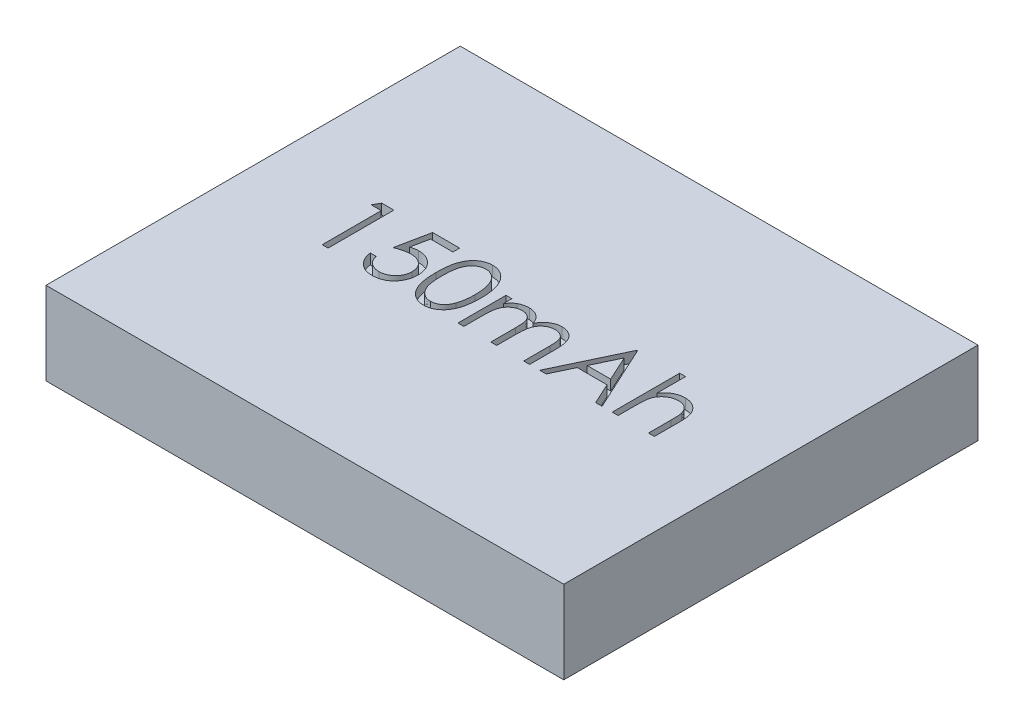
from build123d import *

# Parameters (mm, degrees)
SKETCH1_W           = 25
SKETCH1_H           = 20
BOSS_EXTRUDE1_DEPTH = 4
CUT_EXTRUDE1_DEPTH  = 0.5


with BuildPart() as part:
    # Sketch1 → Boss-Extrude1 (new body)
    with BuildSketch(Plane(origin=(0, 0, 0), x_dir=(1, 0, 0), z_dir=(0, 1, 0))):
        with Locations((12.5, 10)):
            Rectangle(SKETCH1_W, SKETCH1_H)
    extrude(amount=BOSS_EXTRUDE1_DEPTH)

    # Sketch2 → Cut-Extrude1 (cut)
    # profile 1 of 6: a face of its own
    with BuildSketch(Plane(origin=(0, 4, 0), x_dir=(1, 0, 0), z_dir=(0, 1, 0))):
        Polygon((4.668867262, 11.540645792), (5.255911533, 11.540645792), (5.255911533, 8.365645792), (4.970975635, 8.365645792), (4.970975635, 11.215004766), (4.482514097, 11.215004766), align=None)
    # profile 2 of 6: a face of its own
    with BuildSketch(Plane(origin=(0, 4, 0), x_dir=(1, 0, 0), z_dir=(0, 1, 0))):
        with BuildLine():
            Line((8.430911533, 11.540645792), (8.430911533, 11.215004766))
            Line((8.430911533, 11.215004766), (7.351589618, 11.215004766))
            Line((7.351589618, 11.215004766), (7.179864858, 10.37991362))
            add(Edge.make_bspline(
                [(7.179864858, 10.37991362), (7.21347983, 10.389193938), (7.278603521, 10.407173086), (7.374724252, 10.427135464), (7.465975751, 10.439169117), (7.525189837, 10.440812234), (7.553843223, 10.44160733)],
                knots=[0, 0, 0, 0, 1.100273476, 2.13160584, 3.095893838, 4, 4, 4, 4], degree=3))
            add(Edge.make_bspline(
                [(7.553843223, 10.44160733), (7.589297759, 10.440839946), (7.659010234, 10.439331076), (7.761008421, 10.424842327), (7.858374689, 10.402036833), (7.95090541, 10.370177502), (8.038771767, 10.329437959), (8.12116534, 10.278547298), (8.199322876, 10.219099205), (8.271842229, 10.150750516), (8.337632137, 10.075528763), (8.395476999, 9.994649837), (8.444610206, 9.908899744), (8.484126034, 9.817459192), (8.515680394, 9.721339103), (8.536682561, 9.619528117), (8.550667718, 9.512985894), (8.552230169, 9.440138177), (8.553026917, 9.402990543)],
                knots=[0, 0, 0, 0, 1.052922333, 2.070308379, 3.05430497, 4.020497103, 4.973039431, 5.925935799, 6.892292201, 7.88610001, 8.88166317, 9.857072816, 10.836096531, 11.812156883, 12.81219415, 13.836441305, 14.89672472, 16, 16, 16, 16], degree=3))
            add(Edge.make_bspline(
                [(8.553026917, 9.402990543), (8.552423599, 9.377116815), (8.551225116, 9.325719019), (8.545130397, 9.249388208), (8.533395855, 9.174673352), (8.517640848, 9.10156454), (8.497191654, 9.030200181), (8.472436584, 8.960376009), (8.442141616, 8.892526616), (8.408911726, 8.826010007), (8.371495278, 8.762329933), (8.329967632, 8.702776924), (8.286093222, 8.646457611), (8.238884251, 8.593976011), (8.18790192, 8.545676987), (8.133763664, 8.501273903), (8.076901483, 8.46001584), (8.016435656, 8.423577548), (7.953713547, 8.390046867), (7.887829378, 8.362539086), (7.820282886, 8.337945964), (7.750101891, 8.318343036), (7.677445361, 8.30298279), (7.602193529, 8.292550102), (7.524741064, 8.284951477), (7.47224016, 8.28447581), (7.445720227, 8.284235535)],
                knots=[0, 0, 0, 0, 1.056347294, 2.098418968, 3.122841568, 4.141288669, 5.149314143, 6.15115421, 7.162517403, 8.180376062, 9.185164535, 10.17417709, 11.141909838, 12.097768115, 13.052685741, 14.0056014, 14.954263652, 15.917497458, 16.885230207, 17.854509472, 18.828990115, 19.81800267, 20.826176721, 21.857883937, 22.917946725, 24, 24, 24, 24], degree=3))
            add(Edge.make_bspline(
                [(7.445720227, 8.284235535), (7.414084363, 8.284862224), (7.351844538, 8.28609516), (7.260658023, 8.298993357), (7.17292406, 8.317466339), (7.089348896, 8.345257812), (7.009183536, 8.380080572), (6.933507213, 8.424091671), (6.860386259, 8.473965572), (6.792793197, 8.532821321), (6.730058723, 8.597151975), (6.673900676, 8.66696355), (6.623886645, 8.741103829), (6.580817546, 8.819932869), (6.544080055, 8.903243536), (6.515219316, 8.991347973), (6.49192538, 9.083785833), (6.482070706, 9.147425089), (6.477065379, 9.179748356)],
                knots=[0, 0, 0, 0, 1.0467383, 2.05933395, 3.04377827, 4.011590433, 4.970194871, 5.932262533, 6.905835911, 7.896367577, 8.894135286, 9.877477877, 10.858688626, 11.851381753, 12.8477658, 13.868841284, 14.917554742, 16, 16, 16, 16], degree=3))
            Line((6.477065379, 9.179748356), (6.762001276, 9.179748356))
            add(Edge.make_bspline(
                [(6.762001276, 9.179748356), (6.769012182, 9.149471145), (6.782487532, 9.091276666), (6.812065604, 9.009514663), (6.848229648, 8.936653653), (6.891232164, 8.871729817), (6.94253112, 8.815115941), (7.001068531, 8.76466332), (7.066698251, 8.71914731), (7.139626395, 8.681208086), (7.216563974, 8.648851431), (7.297088515, 8.62730525), (7.379007458, 8.612155155), (7.434414265, 8.610638629), (7.462256685, 8.609876561)],
                knots=[0, 0, 0, 0, 1.136247022, 2.183929868, 3.172523383, 4.106158343, 5.02341133, 5.958108904, 6.928429099, 7.938127109, 8.96079061, 9.975095812, 10.982467395, 12, 12, 12, 12], degree=3))
            add(Edge.make_bspline(
                [(7.462256685, 8.609876561), (7.489433274, 8.610621124), (7.5429442, 8.612087174), (7.621694529, 8.623371135), (7.697724779, 8.640749789), (7.770284739, 8.666757443), (7.840644135, 8.69836658), (7.907023198, 8.738929542), (7.971342237, 8.78561113), (8.031602044, 8.839093216), (8.086792116, 8.89803001), (8.135556597, 8.961055932), (8.176175654, 9.0282905), (8.210405881, 9.098569717), (8.236398517, 9.172663837), (8.254941407, 9.250225617), (8.265829896, 9.331446635), (8.267327752, 9.386845223), (8.26809102, 9.415074878)],
                knots=[0, 0, 0, 0, 1.027316725, 2.022795036, 3.002884548, 3.971462791, 4.93288096, 5.914575861, 6.907176829, 7.935150275, 8.956128384, 9.956726525, 10.942570165, 11.921478529, 12.907843606, 13.90538589, 14.932640048, 16, 16, 16, 16], degree=3))
            add(Edge.make_bspline(
                [(8.26809102, 9.415074878), (8.267493685, 9.440543596), (8.266324487, 9.490394986), (8.256771755, 9.563328552), (8.240155645, 9.632337669), (8.217092554, 9.697755581), (8.187810429, 9.75964399), (8.152026988, 9.818066766), (8.109070691, 9.872253886), (8.060001621, 9.922230703), (8.006246113, 9.968354268), (7.946879289, 10.007673546), (7.883143498, 10.040751528), (7.815806647, 10.069297498), (7.743267061, 10.089799603), (7.666961258, 10.105191899), (7.586065245, 10.114095835), (7.530756121, 10.115331263), (7.502325796, 10.115966304)],
                knots=[0, 0, 0, 0, 1.045622112, 2.046656509, 3.013763289, 3.955457236, 4.890082067, 5.820317437, 6.762574623, 7.722996705, 8.69280354, 9.665887285, 10.63943826, 11.638615906, 12.663482002, 13.728887084, 14.832589034, 16, 16, 16, 16], degree=3))
            add(Edge.make_bspline(
                [(7.502325796, 10.115966304), (7.477715982, 10.115439625), (7.426902959, 10.114352167), (7.348958681, 10.106345273), (7.267051189, 10.093428199), (7.181494468, 10.075660674), (7.092031579, 10.052409626), (6.998851315, 10.024547186), (6.901757759, 9.991235087), (6.836336681, 9.966078008), (6.802706405, 9.953145792)],
                knots=[0, 0, 0, 0, 0.817624296, 1.688186739, 2.600797293, 3.572016777, 4.590301741, 5.671205678, 6.80286297, 8, 8, 8, 8], degree=3))
            Line((6.802706405, 9.953145792), (7.12834743, 11.540645792))
            Line((7.12834743, 11.540645792), (8.430911533, 11.540645792))
        make_face()
    # profile 3 of 6: a face of its own
    with BuildSketch(Plane(origin=(0, 4, 0), x_dir=(1, 0, 0), z_dir=(0, 1, 0))):
        with BuildLine():
            add(Edge.make_bspline(
                [(8.878667943, 9.951873756), (8.878965502, 10.002762101), (8.879543516, 10.101613444), (8.885973726, 10.245653798), (8.896655644, 10.38078206), (8.911294546, 10.507004698), (8.929109, 10.624354299), (8.952890191, 10.732517257), (8.979934662, 10.831994186), (9.011278667, 10.923109473), (9.046646161, 11.007090675), (9.085140097, 11.085490679), (9.128288161, 11.15819086), (9.17362436, 11.22635157), (9.222983883, 11.288857065), (9.274962071, 11.346590052), (9.33158763, 11.398216232), (9.390935645, 11.445248235), (9.453543438, 11.486477399), (9.517626428, 11.522792812), (9.583625702, 11.553816977), (9.651721454, 11.578210444), (9.721301631, 11.598358855), (9.79260947, 11.6121374), (9.865762708, 11.620806881), (9.915139795, 11.621635709), (9.940181365, 11.622056048)],
                knots=[0, 0, 0, 0, 1.646270934, 3.197905019, 4.663502075, 6.030701355, 7.308322542, 8.50163776, 9.611534131, 10.641858119, 11.616356847, 12.558055219, 13.465016945, 14.349605745, 15.204443733, 16.039544428, 16.859896111, 17.680448484, 18.487036065, 19.28249412, 20.06191084, 20.843045899, 21.620316918, 22.403196591, 23.190181807, 24, 24, 24, 24], degree=3))
            add(Edge.make_bspline(
                [(9.940181365, 11.622056048), (9.96543212, 11.62161353), (10.015647928, 11.620733501), (10.08988884, 11.612275353), (10.162414623, 11.598240834), (10.232916077, 11.578355379), (10.301972315, 11.553685015), (10.369043199, 11.52276313), (10.434545337, 11.486768729), (10.497437812, 11.444474212), (10.55841107, 11.397318861), (10.615967437, 11.344012726), (10.67011215, 11.285094052), (10.721524749, 11.221193218), (10.768746612, 11.151084605), (10.813716797, 11.075987592), (10.853968573, 10.994588879), (10.892735028, 10.908246597), (10.926196794, 10.814571707), (10.956374031, 10.714092245), (10.980757096, 10.605621376), (11.001067364, 10.48972821), (11.016801662, 10.365987136), (11.028261273, 10.234663407), (11.034314715, 10.095670624), (11.035454722, 10.00064029), (11.036039738, 9.951873756)],
                knots=[0, 0, 0, 0, 0.810914788, 1.612654377, 2.396697861, 3.181598691, 3.963628158, 4.749916497, 5.551656086, 6.361998678, 7.18212741, 8.025565596, 8.878627764, 9.750805457, 10.657531673, 11.591944965, 12.560506719, 13.57287815, 14.630710178, 15.753379473, 16.941251878, 18.199788006, 19.531962791, 20.947069417, 22.433333509, 24, 24, 24, 24], degree=3))
            add(Edge.make_bspline(
                [(11.036039738, 9.951873756), (11.035448658, 9.903319926), (11.034296962, 9.808714766), (11.028329135, 9.670347382), (11.016573805, 9.539720585), (11.00186903, 9.416521094), (10.981502799, 9.301261683), (10.95646097, 9.193543505), (10.928656749, 9.092901382), (10.894335185, 9.000159803), (10.856769755, 8.914025026), (10.815898256, 8.833591256), (10.772110628, 8.758147548), (10.724405124, 8.688297777), (10.67355667, 8.623547138), (10.618476962, 8.565038581), (10.560718645, 8.511362328), (10.499565954, 8.46359978), (10.435692618, 8.421794279), (10.370415455, 8.384407429), (10.302576243, 8.354260627), (10.233712351, 8.328375268), (10.162838761, 8.308599144), (10.090043821, 8.294925004), (10.015697807, 8.285334827), (9.965440673, 8.284603235), (9.940181365, 8.284235535)],
                knots=[0, 0, 0, 0, 1.561518951, 3.042555995, 4.452378317, 5.7783523, 7.031515105, 8.214008947, 9.334062868, 10.386615937, 11.391082383, 12.354592575, 13.286541444, 14.194233754, 15.072674879, 15.931287219, 16.775624067, 17.606195743, 18.42308326, 19.229000347, 20.022332153, 20.807536673, 21.593273796, 22.3848459, 23.188221202, 24, 24, 24, 24], degree=3))
            add(Edge.make_bspline(
                [(9.940181365, 8.284235535), (9.91514049, 8.284658586), (9.865764772, 8.28549276), (9.792601501, 8.294123074), (9.721588141, 8.30799828), (9.652374271, 8.3274262), (9.58460479, 8.351206801), (9.519203158, 8.382189071), (9.455442188, 8.417870691), (9.393491991, 8.458506538), (9.334516673, 8.505062636), (9.278184367, 8.556555955), (9.225910243, 8.614271478), (9.177256456, 8.67729788), (9.131015676, 8.745055321), (9.088480316, 8.818468917), (9.049136755, 8.89724757), (9.013174446, 8.981900246), (8.981289587, 9.073662217), (8.95312488, 9.173583257), (8.930887038, 9.282545299), (8.911852499, 9.399673196), (8.896499666, 9.525470261), (8.886018243, 9.660004789), (8.87954005, 9.803192942), (8.87896395, 9.901409095), (8.878667943, 9.951873756)],
                knots=[0, 0, 0, 0, 0.810891512, 1.598919785, 2.382837074, 3.152667961, 3.926044502, 4.706494248, 5.493654104, 6.291793342, 7.103789334, 7.925228297, 8.761435821, 9.622817696, 10.50288917, 11.416980706, 12.369136599, 13.353924996, 14.394355917, 15.514179734, 16.714354668, 17.994756427, 19.357759367, 20.818452758, 22.365282078, 24, 24, 24, 24], degree=3))
        make_face()
        with BuildLine():
            add(Edge.make_bspline(
                [(9.16360384, 9.953145792), (9.163712196, 9.910738043), (9.163922493, 9.828432931), (9.169416332, 9.708832259), (9.176900471, 9.597280603), (9.186553648, 9.493636324), (9.20088918, 9.398250241), (9.216951766, 9.310466314), (9.236498961, 9.230749106), (9.259626585, 9.158551592), (9.285969194, 9.092648509), (9.314730942, 9.031324549), (9.345628883, 8.973855293), (9.380208398, 8.920756948), (9.417868491, 8.871856356), (9.457758519, 8.826288001), (9.501367221, 8.78565074), (9.561695616, 8.736912807), (9.64133956, 8.686549021), (9.741688116, 8.642692211), (9.84480164, 8.615130983), (9.914788845, 8.611626004), (9.949721629, 8.609876561)],
                knots=[0, 0, 0, 0, 1.459021318, 2.831673884, 4.118529203, 5.306027144, 6.411944654, 7.436330062, 8.375795394, 9.233974572, 10.042671642, 10.816086306, 11.563610507, 12.285937304, 12.993564865, 13.685989202, 14.367179055, 15.041617293, 16.353048772, 17.594441528, 18.799311195, 20, 20, 20, 20], degree=3))
            add(Edge.make_bspline(
                [(9.949721629, 8.609876561), (9.984880374, 8.611325976), (10.055125274, 8.614221815), (10.157753788, 8.642160669), (10.257385533, 8.68431518), (10.335465079, 8.734160417), (10.394867101, 8.781629687), (10.437427513, 8.822101547), (10.476490943, 8.867418655), (10.513540539, 8.916313016), (10.547521272, 8.96971877), (10.578421404, 9.027379106), (10.606618441, 9.089454146), (10.622683076, 9.132788124), (10.630896509, 9.154943668)],
                knots=[0, 0, 0, 0, 1.353760809, 2.704726607, 4.075137775, 5.516104923, 6.260822281, 7.007110065, 7.778089737, 8.566572457, 9.372053459, 10.217411131, 11.088608312, 12, 12, 12, 12], degree=3))
            add(Edge.make_bspline(
                [(10.630896509, 9.154943668), (10.64046847, 9.183273503), (10.659903655, 9.240795218), (10.684951479, 9.330025102), (10.704677662, 9.423644753), (10.72242443, 9.52109468), (10.734537559, 9.623093551), (10.744287361, 9.729325771), (10.750030199, 9.839871435), (10.75074208, 9.91497832), (10.75110384, 9.953145792)],
                knots=[0, 0, 0, 0, 0.884706709, 1.796334032, 2.740027952, 3.714592787, 4.726048262, 5.777819803, 6.87074269, 8, 8, 8, 8], degree=3))
            add(Edge.make_bspline(
                [(10.75110384, 9.953145792), (10.75060474, 9.99130709), (10.749628393, 10.065958746), (10.745896419, 10.175285953), (10.736259319, 10.279124565), (10.725555833, 10.377921922), (10.709774068, 10.471131125), (10.692758057, 10.559532473), (10.669896958, 10.642030789), (10.645476876, 10.719917695), (10.617527446, 10.792308289), (10.58676103, 10.859540081), (10.55390272, 10.921937652), (10.518213688, 10.979329807), (10.480117604, 11.031973613), (10.43860897, 11.078813567), (10.395334289, 11.121301388), (10.334721556, 11.169799576), (10.255369879, 11.219249471), (10.156631327, 11.264756982), (10.053878671, 11.290890219), (9.984415609, 11.294574749), (9.949721629, 11.296415022)],
                knots=[0, 0, 0, 0, 1.31362396, 2.569729283, 3.763502607, 4.902122613, 5.988968491, 7.01645872, 7.998833611, 8.933434873, 9.825090667, 10.667526885, 11.477055099, 12.250526234, 12.991942729, 13.710640831, 14.402115721, 15.076753259, 16.378508321, 17.609869233, 18.806226677, 20, 20, 20, 20], degree=3))
            add(Edge.make_bspline(
                [(9.949721629, 11.296415022), (9.914605592, 11.29457221), (9.844309545, 11.290883228), (9.7404889, 11.264854348), (9.640971381, 11.219485443), (9.56182954, 11.169635791), (9.501174533, 11.122157466), (9.458463804, 11.080985468), (9.41841692, 11.035949223), (9.381525506, 10.986598915), (9.346973085, 10.933562474), (9.315240309, 10.876422666), (9.286649588, 10.814889929), (9.260265759, 10.749016448), (9.237067587, 10.676825163), (9.217932349, 10.597206147), (9.200254808, 10.509701431), (9.187740528, 10.413798735), (9.17661555, 10.310128495), (9.169466042, 10.198298357), (9.163904115, 10.078497097), (9.163705937, 9.995766432), (9.16360384, 9.953145792)],
                knots=[0, 0, 0, 0, 1.207732386, 2.417664972, 3.655092373, 4.956220595, 5.625982001, 6.301752483, 6.994047911, 7.697131622, 8.419323945, 9.170223765, 9.943494443, 10.752040957, 11.610060368, 12.549350801, 13.567764191, 14.679664412, 15.874934091, 17.154273443, 18.533957287, 20, 20, 20, 20], degree=3))
        make_face(mode=Mode.SUBTRACT)
    # profile 4 of 6: a face of its own
    with BuildSketch(Plane(origin=(0, 4, 0), x_dir=(1, 0, 0), z_dir=(0, 1, 0))):
        with BuildLine():
            Line((11.524501276, 10.685838099), (11.809437174, 10.685838099))
            Line((11.809437174, 10.685838099), (11.809437174, 10.282602923))
            add(Edge.make_bspline(
                [(11.809437174, 10.282602923), (11.835094757, 10.317879533), (11.884257146, 10.3854729), (11.964870988, 10.474545515), (12.045403604, 10.550136055), (12.103400315, 10.589817089), (12.131262094, 10.608879966)],
                knots=[0, 0, 0, 0, 1.134379233, 2.173579362, 3.122582517, 4, 4, 4, 4], degree=3))
            add(Edge.make_bspline(
                [(12.131262094, 10.608879966), (12.169239323, 10.62702769), (12.244530275, 10.663006077), (12.363746286, 10.699503662), (12.485734022, 10.721932862), (12.568110045, 10.72500025), (12.60954735, 10.726543227)],
                knots=[0, 0, 0, 0, 1.014936303, 2.012140481, 3.000054389, 4, 4, 4, 4], degree=3))
            add(Edge.make_bspline(
                [(12.60954735, 10.726543227), (12.637571711, 10.725594999), (12.693030415, 10.723718507), (12.775203125, 10.711508332), (12.854903438, 10.69040259), (12.93166045, 10.661004517), (13.003978495, 10.625402165), (13.070280838, 10.583628502), (13.12981137, 10.536731869), (13.182540002, 10.482594551), (13.229955475, 10.419696351), (13.273569858, 10.346340926), (13.313869872, 10.260881119), (13.336204916, 10.198862899), (13.347963816, 10.166211697)],
                knots=[0, 0, 0, 0, 1.009824226, 1.998387844, 2.986035974, 3.974953746, 4.955485308, 5.885931332, 6.793869504, 7.679848016, 8.601185859, 9.625726857, 10.749998409, 12, 12, 12, 12], degree=3))
            add(Edge.make_bspline(
                [(13.347963816, 10.166211697), (13.36040188, 10.188640277), (13.384878243, 10.232776574), (13.425976928, 10.295240854), (13.469037, 10.353667016), (13.514425433, 10.408101415), (13.561982023, 10.458275242), (13.611930579, 10.504354381), (13.663986773, 10.546536718), (13.736369734, 10.595815584), (13.830542599, 10.648158798), (13.949276818, 10.693541744), (14.072784473, 10.721587089), (14.156620528, 10.724880265), (14.198955403, 10.726543227)],
                knots=[0, 0, 0, 0, 0.86119277, 1.694706429, 2.50939023, 3.298075842, 4.073795165, 4.829715201, 5.57930267, 6.321991688, 7.768977793, 9.186738141, 10.579381044, 12, 12, 12, 12], degree=3))
            add(Edge.make_bspline(
                [(14.198955403, 10.726543227), (14.237855016, 10.725076177), (14.313985335, 10.722205017), (14.424817569, 10.699659366), (14.528179063, 10.660944644), (14.62386184, 10.608118416), (14.710185385, 10.541734443), (14.785220894, 10.462750569), (14.84851258, 10.371725475), (14.889858918, 10.286098457), (14.917903479, 10.210501405), (14.935194741, 10.146088555), (14.950470751, 10.075193932), (14.963153737, 9.997732766), (14.972423424, 9.913431428), (14.979291144, 9.822427877), (14.983939411, 9.724651382), (14.984267862, 9.65719125), (14.984437174, 9.622416625)],
                knots=[0, 0, 0, 0, 1.209669288, 2.367440248, 3.500751976, 4.631527125, 5.755587489, 6.87532382, 8.007944318, 9.190864318, 9.82315674, 10.514484317, 11.263564316, 12.079023757, 12.955305781, 13.901327259, 14.918167583, 16, 16, 16, 16], degree=3))
            Line((14.984437174, 9.622416625), (14.984437174, 8.365645792))
            Line((14.984437174, 8.365645792), (14.699501276, 8.365645792))
            Line((14.699501276, 8.365645792), (14.699501276, 9.62368866))
            add(Edge.make_bspline(
                [(14.699501276, 9.62368866), (14.699430625, 9.653370895), (14.699294845, 9.710415636), (14.696851336, 9.792287503), (14.692247301, 9.866916656), (14.686863736, 9.934201336), (14.679385423, 9.994298451), (14.669728043, 10.047087288), (14.659497576, 10.092983102), (14.642501355, 10.14386116), (14.615334339, 10.199986279), (14.573952768, 10.260514094), (14.521819172, 10.313201677), (14.46162103, 10.358938293), (14.393087798, 10.396125382), (14.317554799, 10.422682905), (14.235490981, 10.439122945), (14.178683165, 10.440761259), (14.149346028, 10.44160733)],
                knots=[0, 0, 0, 0, 1.253487763, 2.409012846, 3.458416907, 4.410876679, 5.259312806, 6.014470957, 6.676830364, 7.243083969, 8.276244668, 9.299465089, 10.325150304, 11.392391894, 12.482080715, 13.603491619, 14.762376348, 16, 16, 16, 16], degree=3))
            add(Edge.make_bspline(
                [(14.149346028, 10.44160733), (14.113359712, 10.440322673), (14.042237071, 10.437783702), (13.938418666, 10.411863117), (13.838659244, 10.372783176), (13.745935516, 10.316148018), (13.660638877, 10.248286145), (13.587251403, 10.167596155), (13.526625063, 10.076310435), (13.485573242, 9.99181307), (13.459638662, 9.915912931), (13.442514603, 9.849603173), (13.429194669, 9.774236322), (13.416702832, 9.690318812), (13.408549679, 9.597273006), (13.401139798, 9.495529313), (13.39767373, 9.384781722), (13.397188899, 9.308013225), (13.396937174, 9.268154806)],
                knots=[0, 0, 0, 0, 1.090531906, 2.155305635, 3.229839962, 4.33261226, 5.44038871, 6.529323825, 7.629011124, 8.757537029, 9.370236727, 10.061839251, 10.834451254, 11.692844982, 12.636905849, 13.66920014, 14.789842145, 16, 16, 16, 16], degree=3))
            Line((13.396937174, 9.268154806), (13.396937174, 8.365645792))
            Line((13.396937174, 8.365645792), (13.112001276, 8.365645792))
            Line((13.112001276, 8.365645792), (13.112001276, 9.545458492))
            add(Edge.make_bspline(
                [(13.112001276, 9.545458492), (13.111929221, 9.578744574), (13.111790594, 9.64278365), (13.109362792, 9.734617056), (13.104748499, 9.81814775), (13.099414002, 9.893278649), (13.091739411, 9.959873211), (13.083021984, 10.018288456), (13.072727173, 10.068377938), (13.055682064, 10.12331758), (13.029633939, 10.183842988), (12.987734587, 10.248378057), (12.935476282, 10.304864117), (12.874179845, 10.353086696), (12.805231833, 10.392947897), (12.729046891, 10.421667815), (12.646311006, 10.438381278), (12.589271944, 10.4405117), (12.559937975, 10.44160733)],
                knots=[0, 0, 0, 0, 1.320475261, 2.540461679, 3.643808994, 4.639130445, 5.527981419, 6.302341397, 6.981980563, 7.553956391, 8.582137848, 9.585246428, 10.591171744, 11.620968678, 12.668337649, 13.738356861, 14.836885341, 16, 16, 16, 16], degree=3))
            add(Edge.make_bspline(
                [(12.559937975, 10.44160733), (12.52545184, 10.440218984), (12.456722199, 10.43745206), (12.355755412, 10.412547112), (12.258250542, 10.373536272), (12.165763065, 10.319416294), (12.08078723, 10.252379272), (12.006394017, 10.173535046), (11.943853297, 10.083864851), (11.902368008, 10.000258468), (11.875608678, 9.926259854), (11.85783291, 9.863348638), (11.842556963, 9.793498412), (11.831204958, 9.716493676), (11.820246295, 9.632835969), (11.814957372, 9.542108539), (11.809812455, 9.444389217), (11.809565336, 9.376922693), (11.809437174, 9.341932851)],
                knots=[0, 0, 0, 0, 1.098833095, 2.189935336, 3.297829714, 4.440610912, 5.596351641, 6.740013378, 7.886572111, 9.072425424, 9.705826452, 10.395263256, 11.156850408, 11.985370555, 12.878090359, 13.847760091, 14.883794034, 16, 16, 16, 16], degree=3))
            Line((11.809437174, 9.341932851), (11.809437174, 8.365645792))
            Line((11.809437174, 8.365645792), (11.524501276, 8.365645792))
            Line((11.524501276, 8.365645792), (11.524501276, 10.685838099))
        make_face()
    # profile 5 of 6: a face of its own
    with BuildSketch(Plane(origin=(0, 4, 0), x_dir=(1, 0, 0), z_dir=(0, 1, 0))):
        Polygon((17.019693584, 11.540645792), (18.485078199, 8.365645792), (18.175337615, 8.365645792), (17.705956605, 9.383273997), (16.266648712, 9.383273997), (15.78454735, 8.365645792), (15.472898712, 8.365645792), (16.978988456, 11.540645792), align=None)
        Polygon((16.996160932, 10.921164622), (16.421837014, 9.708915022), (17.555856445, 9.708915022), align=None, mode=Mode.SUBTRACT)
    # profile 6 of 6: a face of its own
    with BuildSketch(Plane(origin=(0, 4, 0), x_dir=(1, 0, 0), z_dir=(0, 1, 0))):
        with BuildLine():
            Line((18.973539738, 11.622056048), (19.258475635, 11.622056048))
            Line((19.258475635, 11.622056048), (19.258475635, 10.247621953))
            add(Edge.make_bspline(
                [(19.258475635, 10.247621953), (19.289062045, 10.285852566), (19.348615351, 10.360289527), (19.448851114, 10.457409322), (19.551785405, 10.541590928), (19.660973483, 10.608601986), (19.774412169, 10.661539707), (19.892579903, 10.699084215), (20.015498642, 10.722171995), (20.098978599, 10.725073417), (20.141268103, 10.726543227)],
                knots=[0, 0, 0, 0, 1.125788106, 2.19196713, 3.20547328, 4.180437432, 5.132270164, 6.079753143, 7.027236121, 8, 8, 8, 8], degree=3))
            add(Edge.make_bspline(
                [(20.141268103, 10.726543227), (20.184203531, 10.724959873), (20.26823852, 10.721860866), (20.390595275, 10.69735587), (20.504859783, 10.65548448), (20.610692369, 10.598182965), (20.705783344, 10.526815471), (20.790011345, 10.444418304), (20.858809784, 10.348919821), (20.905617554, 10.260694505), (20.936073431, 10.182191493), (20.955351874, 10.114848371), (20.971697861, 10.039807778), (20.985939764, 9.957108342), (20.995431727, 9.86635308), (21.003055916, 9.767951435), (21.008477414, 9.661909049), (21.008687513, 9.588502823), (21.008796148, 9.550546633)],
                knots=[0, 0, 0, 0, 1.235656852, 2.418478516, 3.575258207, 4.727955599, 5.870717718, 6.98870536, 8.107142894, 9.245821548, 9.854588956, 10.528768408, 11.260415777, 12.065282286, 12.943670737, 13.886611085, 14.907229059, 16, 16, 16, 16], degree=3))
            Line((21.008796148, 9.550546633), (21.008796148, 8.365645792))
            Line((21.008796148, 8.365645792), (20.723860251, 8.365645792))
            Line((20.723860251, 8.365645792), (20.723860251, 9.457052042))
            add(Edge.make_bspline(
                [(20.723860251, 9.457052042), (20.723687619, 9.488641178), (20.723357403, 9.549065818), (20.722265797, 9.635576502), (20.719829016, 9.714040853), (20.715891267, 9.784207402), (20.711749881, 9.846173971), (20.706050015, 9.89985057), (20.699418588, 9.945310924), (20.693459765, 9.972674551), (20.690787334, 9.984946673)],
                knots=[0, 0, 0, 0, 1.430932559, 2.737130458, 3.918967929, 4.986496826, 5.920444988, 6.731744033, 7.431208747, 8, 8, 8, 8], degree=3))
            add(Edge.make_bspline(
                [(20.690787334, 9.984946673), (20.680423912, 10.020955041), (20.660500293, 10.090180918), (20.614192485, 10.184217533), (20.556353953, 10.264395119), (20.485735366, 10.329631652), (20.403585993, 10.380804977), (20.309370168, 10.416245036), (20.20397462, 10.438241184), (20.129723643, 10.440453981), (20.091022711, 10.44160733)],
                knots=[0, 0, 0, 0, 1.090059168, 2.095632401, 3.037101401, 3.955032261, 4.878929692, 5.839099886, 6.873700383, 8, 8, 8, 8], degree=3))
            add(Edge.make_bspline(
                [(20.091022711, 10.44160733), (20.068101231, 10.441175688), (20.022740214, 10.440321478), (19.955476782, 10.431745442), (19.890226845, 10.417731247), (19.826362013, 10.398767844), (19.765235826, 10.372963679), (19.70506656, 10.343091293), (19.647558956, 10.306525947), (19.591691822, 10.265499715), (19.539696631, 10.22007929), (19.491321319, 10.172139553), (19.448197254, 10.121090121), (19.409127889, 10.067750016), (19.375401873, 10.011387603), (19.345962291, 9.9525464), (19.320983481, 9.891149025), (19.308571324, 9.848535933), (19.302360852, 9.827214301)],
                knots=[0, 0, 0, 0, 1.024319606, 2.027102035, 3.025350316, 4.005802111, 5.00026367, 5.987881639, 7.005602596, 8.042517216, 9.083927026, 10.089214625, 11.084353441, 12.06828073, 13.041928858, 14.016821737, 15.00770877, 16, 16, 16, 16], degree=3))
            add(Edge.make_bspline(
                [(19.302360852, 9.827214301), (19.298787228, 9.811773867), (19.290999863, 9.778127261), (19.282549979, 9.72263341), (19.274986406, 9.658147915), (19.268592365, 9.584768585), (19.264670708, 9.50222653), (19.260445018, 9.411085017), (19.25887202, 9.310773141), (19.258611712, 9.24101793), (19.258475635, 9.204553043)],
                knots=[0, 0, 0, 0, 0.607992626, 1.324890765, 2.152360218, 3.099583803, 4.150613268, 5.323148443, 6.60066238, 8, 8, 8, 8], degree=3))
            Line((19.258475635, 9.204553043), (19.258475635, 8.365645792))
            Line((19.258475635, 8.365645792), (18.973539738, 8.365645792))
            Line((18.973539738, 8.365645792), (18.973539738, 11.622056048))
        make_face()
    extrude(amount=-CUT_EXTRUDE1_DEPTH, mode=Mode.SUBTRACT)


solid = part.part
